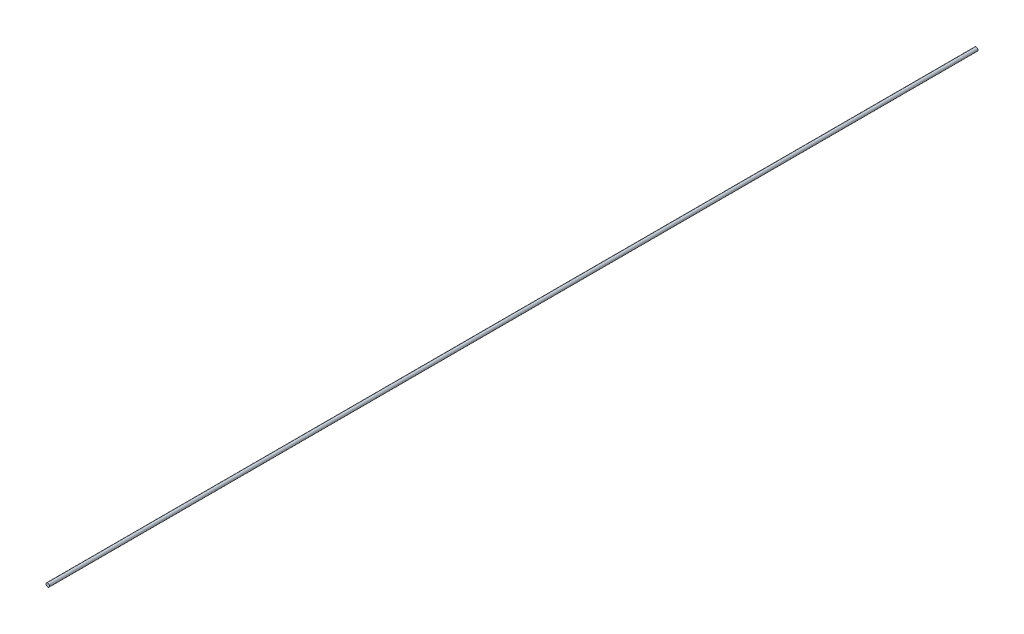
from build123d import *

# Parameters (mm, degrees)
SKETCH1_R           = 2
BOSS_EXTRUDE1_DEPTH = 1034.05


with BuildPart() as part:
    # Sketch1 → Boss-Extrude1 (new body)
    with BuildSketch(Plane.XY):
        Circle(SKETCH1_R)
    extrude(amount=BOSS_EXTRUDE1_DEPTH)


solid = part.part
